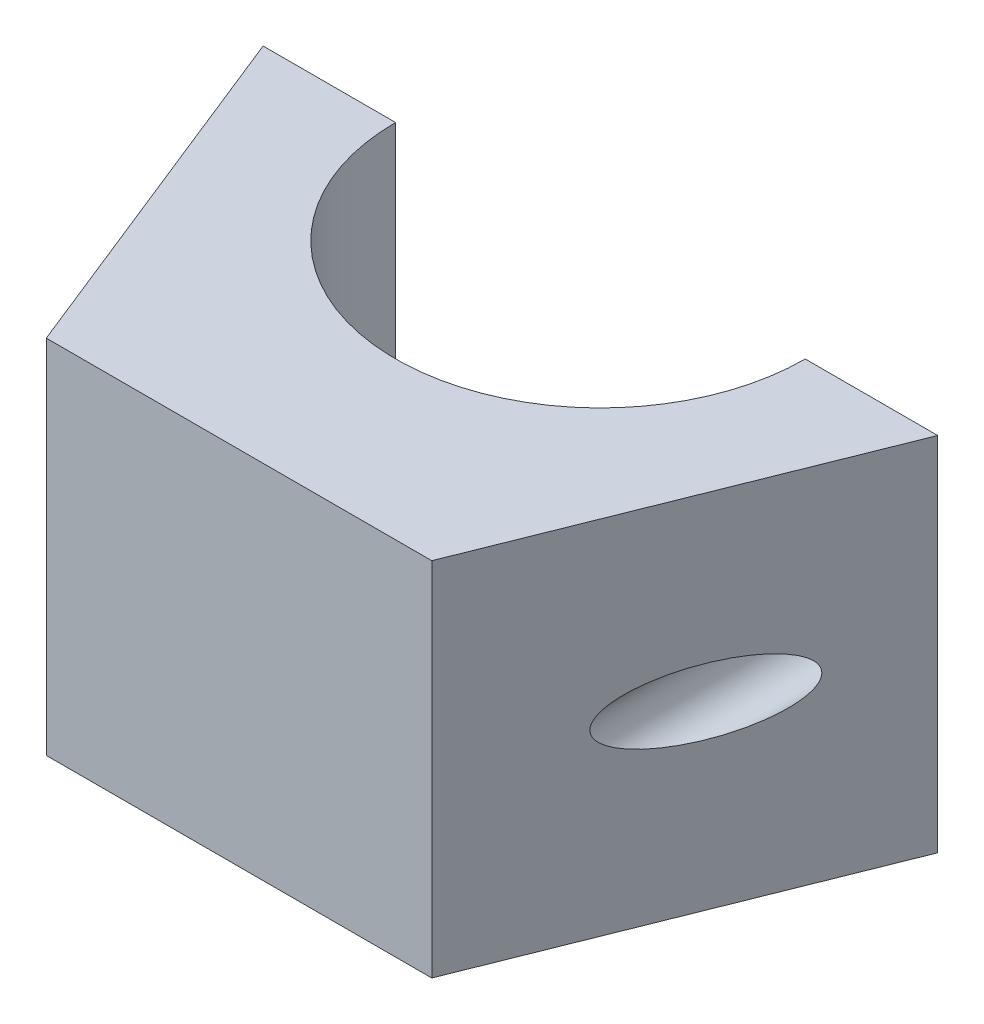
from build123d import *

# Parameters (mm, degrees)
SKETCH1_W           = 40
SKETCH1_H           = 30
BOSS_EXTRUDE1_DEPTH = 15
CUT_EXTRUDE1_DEPTH  = 15
SKETCH3_R           = 1.375
CUT_EXTRUDE2_DEPTH  = 15


with BuildPart() as part:
    # Sketch1 → Boss-Extrude1 (new body)
    with BuildSketch(Plane(origin=(0, 0, 0), x_dir=(1, 0, 0), z_dir=(0, 1, 0))):
        with Locations((-14.816176471, 3.033088235)):
            Rectangle(SKETCH1_W, SKETCH1_H)
    extrude(amount=BOSS_EXTRUDE1_DEPTH)

    # Sketch2 → Cut-Extrude1 (cut)
    with BuildSketch(Plane(origin=(0, 15, 0), x_dir=(1, 0, 0), z_dir=(0, 1, 0))):
        Polygon((-28.816176471, 3.033088235), (-28.816176471, 18.033088235), (-34.816176471, 18.033088235), align=None)
        with BuildLine():
            Line((-0.816176471, 18.033088235), (-28.816176471, 18.033088235))
            Line((-28.816176471, 18.033088235), (-28.816176471, 3.033088235))
            Line((-28.816176471, 3.033088235), (-23.316176471, 3.033088235))
            ThreePointArc((-23.316176471, 3.033088235), (-14.816176471, 11.533088235), (-6.316176471, 3.033088235))
            Line((-6.316176471, 3.033088235), (-0.816176471, 3.033088235))
            Line((-0.816176471, 3.033088235), (-0.816176471, 18.033088235))
        make_face()
        Polygon((5.183823529, 18.033088235), (-0.816176471, 18.033088235), (-0.816176471, 3.033088235), align=None)
        Polygon((5.183823529, 18.033088235), (-0.816176471, 3.033088235), (-0.816176471, -11.966911765), (5.183823529, -11.966911765), align=None)
        Polygon((-0.816176471, -11.966911765), (-0.816176471, 3.033088235), (-6.816176471, -11.966911765), align=None)
        Polygon((-22.816176471, -11.966911765), (-28.816176471, 3.033088235), (-28.816176471, -11.966911765), align=None)
        Polygon((-28.816176471, -11.966911765), (-28.816176471, 3.033088235), (-34.816176471, 18.033088235), (-34.816176471, -11.966911765), align=None)
        with BuildLine():
            ThreePointArc((-6.316176471, 3.033088235), (-14.816176471, 11.533088235), (-23.316176471, 3.033088235))
            Line((-23.316176471, 3.033088235), (-6.316176471, 3.033088235))
        make_face()
        with BuildLine():
            Line((-6.316176471, 3.033088235), (-23.316176471, 3.033088235))
            ThreePointArc((-23.316176471, 3.033088235), (-14.816176471, -5.466911765), (-6.316176471, 3.033088235))
        make_face()
    extrude(amount=-CUT_EXTRUDE1_DEPTH, mode=Mode.SUBTRACT)

    # Sketch3 → Cut-Extrude2 (cut)
    with BuildSketch(Plane(origin=(0, 0, -3.033088235), x_dir=(-1, 0, 0), z_dir=(0, 0, -1))):
        with Locations((3.566176471, 7.5)):
            Circle(SKETCH3_R)
        with Locations((26.066176471, 7.5)):
            Circle(SKETCH3_R)
    extrude(amount=-CUT_EXTRUDE2_DEPTH, mode=Mode.SUBTRACT)


solid = part.part
